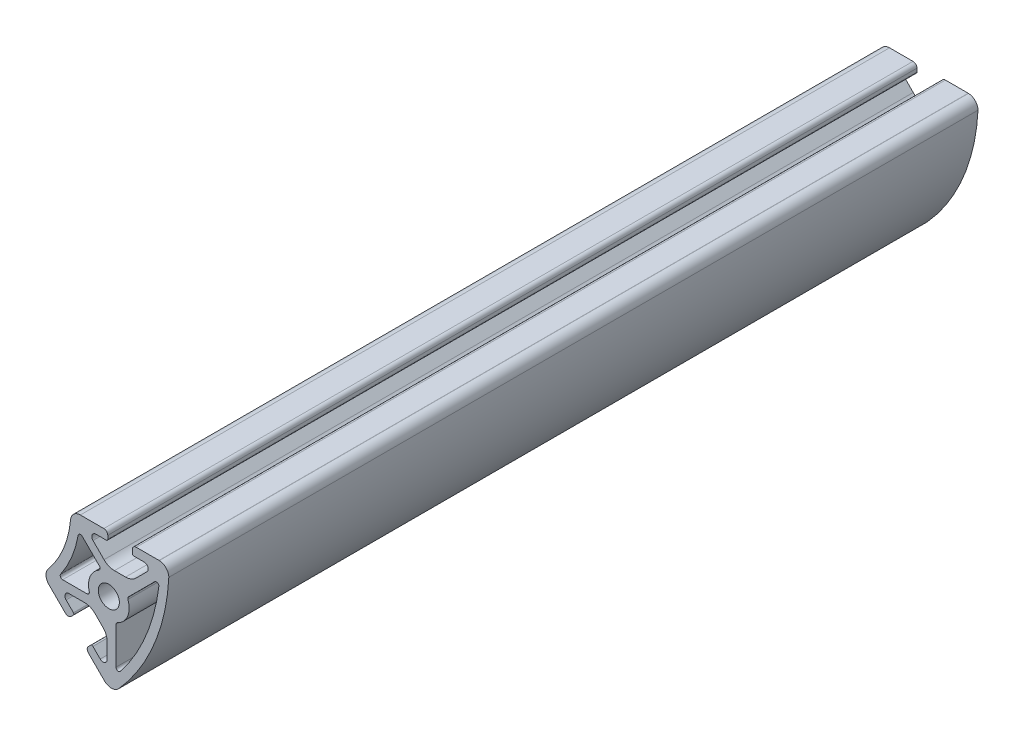
from build123d import *

# Parameters (mm, degrees)
BOSS_EXTRUDE1_DEPTH = 165


with BuildPart() as part:
    # Sketch1 → Boss-Extrude1 (new body)
    with BuildSketch(Plane.XY):
        with BuildLine():
            Line((-17.933849058, 1.310471954), (-17.438874304, 1.805446694))
            ThreePointArc((-17.438874304, 1.805446694), (-17.351006338, 2.017578728), (-17.438874304, 2.229710762))
            Line((-17.438874304, 2.229710762), (-18.936235421, 3.72707188))
            ThreePointArc((-18.936235421, 3.72707188), (-19.116679575, 4.6342259), (-18.347631531, 5.148087374))
            Line((-18.347631531, 5.148087374), (-15.165219907, 5.148087374))
            ThreePointArc((-15.165219907, 5.148087374), (-14.01716961, 4.919725971), (-13.043899564, 4.269407717))
            Line((-13.043899564, 4.269407717), (-11.439379376, 2.66488753))
            ThreePointArc((-11.439379376, 2.66488753), (-10.789061123, 1.691617485), (-10.560699721, 0.54356719))
            Line((-10.560699721, 0.54356719), (-10.560699721, -2.638844434))
            ThreePointArc((-10.560699721, -2.638844434), (-11.074561199, -3.407892483), (-11.981715225, -3.227448328))
            Line((-11.981715225, -3.227448328), (-13.479076343, -1.730087211))
            ThreePointArc((-13.479076343, -1.730087211), (-13.691208377, -1.642219245), (-13.903340412, -1.730087211))
            Line((-13.903340412, -1.730087211), (-14.398315158, -2.225061958))
            ThreePointArc((-14.398315158, -2.225061958), (-14.632629733, -2.790747383), (-14.398315158, -3.356432808))
            Line((-14.398315158, -3.356432808), (-11.091426526, -6.66332144))
            Line((-11.091426526, -6.66332144), (-11.021736276, -6.72655883))
            ThreePointArc((-11.021736276, -6.72655883), (-9.637071865, -7.232037367), (-8.282153045, -6.651521154))
            ThreePointArc((-8.282153045, -6.651521154), (-0.986587883, 4.879678298), (2.008460712, 18.19221058))
            ThreePointArc((2.008460712, 18.19221058), (1.440783284, 19.581695132), (0.06638279, 20.184976381))
            ThreePointArc((0.06638279, 20.184976381), (0.035983891, 20.186304583), (0.00556439, 20.187019567))
            Line((0.00556439, 20.187019567), (-4.64176753, 20.187019567))
            ThreePointArc((-4.64176753, 20.187019567), (-5.207452955, 19.952704992), (-5.44176753, 19.387019567))
            Line((-5.44176753, 19.387019567), (-5.44176754, 18.687019567))
            ThreePointArc((-5.44176754, 18.687019567), (-5.353899574, 18.474887532), (-5.14176754, 18.387019567))
            Line((-5.14176754, 18.387019567), (-3.02417914, 18.387019567))
            ThreePointArc((-3.02417914, 18.387019567), (-2.255131096, 17.873158092), (-2.43557525, 16.966004073))
            Line((-2.43557525, 16.966004073), (-4.68588009, 14.715699233))
            ThreePointArc((-4.68588009, 14.715699233), (-5.659150136, 14.065380979), (-6.807200433, 13.837019576))
            Line((-6.807200433, 13.837019576), (-9.076334643, 13.837019576))
            ThreePointArc((-9.076334643, 13.837019576), (-10.224384938, 14.065380978), (-11.197654983, 14.715699231))
            Line((-11.197654983, 14.715699231), (-13.447959823, 16.966004071))
            ThreePointArc((-13.447959823, 16.966004071), (-13.628403978, 17.873158097), (-12.859355929, 18.387019575))
            Line((-12.859355929, 18.387019575), (-10.741767529, 18.387019575))
            ThreePointArc((-10.741767529, 18.387019575), (-10.529635495, 18.474887541), (-10.441767529, 18.687019575))
            Line((-10.441767529, 18.687019575), (-10.441767529, 19.387019575))
            ThreePointArc((-10.441767529, 19.387019575), (-10.676082104, 19.952705), (-11.241767529, 20.187019575))
            Line((-11.241767529, 20.187019575), (-16.032865229, 20.187019575))
            ThreePointArc((-16.032865229, 20.187019575), (-17.381264954, 19.664117467), (-18.02458362, 18.368837756))
            ThreePointArc((-18.02458362, 18.368837756), (-19.464176878, 12.533350929), (-22.57254303, 7.389092466))
            ThreePointArc((-22.57254303, 7.389092466), (-23.035584519, 6.097289793), (-22.557062201, 4.811141295))
            Line((-22.557062201, 4.811141295), (-22.41767475, 4.662926796))
            Line((-22.41767475, 4.662926796), (-19.065219908, 1.310471954))
            ThreePointArc((-19.065219908, 1.310471954), (-18.499534483, 1.076157379), (-17.933849058, 1.310471954))
        make_face()
        with BuildLine():
            Line((-12.14365631, 13.117817809), (-15.63660261, 16.610764109))
            ThreePointArc((-15.63660261, 16.610764109), (-16.139874769, 16.734268673), (-16.482327269, 16.345343836))
            ThreePointArc((-16.482327269, 16.345343836), (-17.800420542, 11.845449218), (-20.050293851, 7.731510528))
            ThreePointArc((-20.050293851, 7.731510528), (-20.083154751, 7.214348654), (-19.63995668, 6.945812413))
            Line((-19.63995668, 6.945812413), (-14.70018465, 6.945812413))
            ThreePointArc((-14.70018465, 6.945812413), (-14.301543386, 7.144009261), (-14.21893989, 7.581471843))
            ThreePointArc((-14.21893989, 7.581471843), (-14.058708433, 10.295581323), (-12.252843967, 12.328047292))
            ThreePointArc((-12.252843967, 12.328047292), (-12.001920705, 12.695789539), (-12.14365631, 13.117817809))
        make_face(mode=Mode.SUBTRACT)
        with BuildLine():
            Line((-0.870882283, 15.9852679), (-6.207568998, 10.648581185))
            ThreePointArc((-6.207568998, 10.648581185), (-6.342128781, 10.40340459), (-6.323971818, 10.124319975))
            ThreePointArc((-6.323971818, 10.124319975), (-6.390508312, 7.119308828), (-8.468323669, 4.947396666))
            ThreePointArc((-8.468323669, 4.947396666), (-8.678505203, 4.762892953), (-8.7567231, 4.494378786))
            Line((-8.7567231, 4.494378786), (-8.7567231, -3.052835944))
            ThreePointArc((-8.7567231, -3.052835944), (-8.419748711, -3.525511996), (-7.8630325, -3.361069154))
            ThreePointArc((-7.8630325, -3.361069154), (-2.648796205, 5.569440932), (-0.020993808, 15.571287015))
            ThreePointArc((-0.020993808, 15.571287015), (-0.298372973, 16.081223462), (-0.870882283, 15.9852679))
        make_face(mode=Mode.SUBTRACT)
        with BuildLine():
            ThreePointArc((-12.37538155, 8.706516606), (-10.22538155, 6.556516606), (-8.07538155, 8.706516606))
            ThreePointArc((-8.07538155, 8.706516606), (-10.22538155, 10.856516606), (-12.37538155, 8.706516606))
        make_face(mode=Mode.SUBTRACT)
    extrude(amount=BOSS_EXTRUDE1_DEPTH)


solid = part.part
